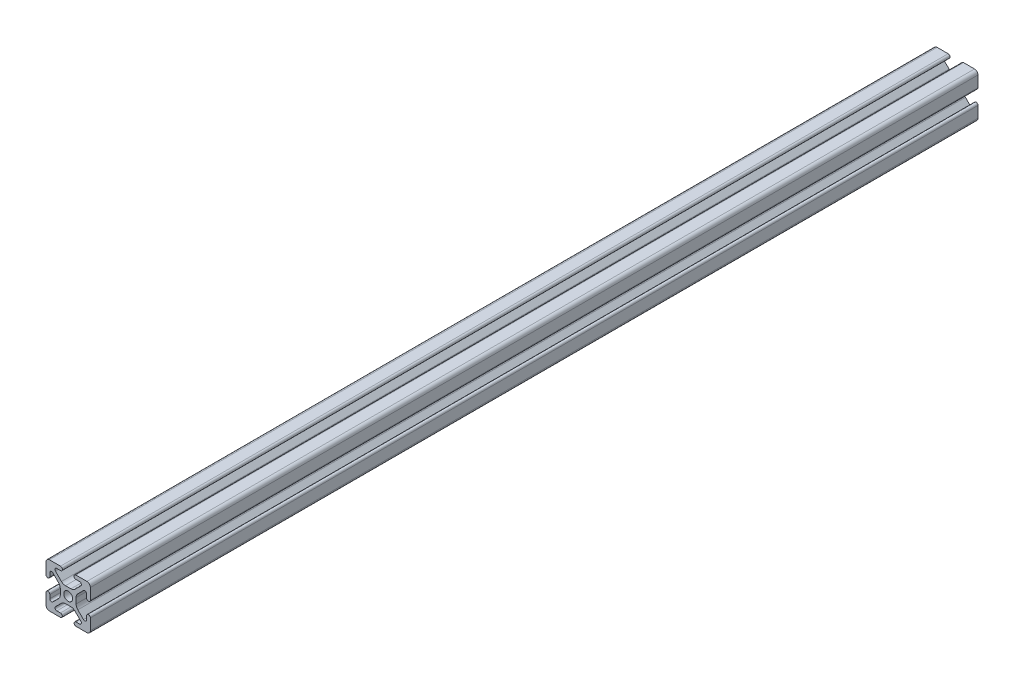
from build123d import *

# Parameters (mm, degrees)
SKETCH1_R           = 2.5
BOSS_EXTRUDE1_DEPTH = 500


with BuildPart() as part:
    # Sketch1 → Boss-Extrude1 (new body)
    with BuildSketch(Plane(origin=(0, 0, -4000), x_dir=(-1, 0, 0), z_dir=(0, 0, -1))):
        with BuildLine():
            Line((12.5, 4.32), (12.5, 10.537068835))
            ThreePointArc((12.5, 10.537068835), (11.925070773, 11.925070773), (10.537068835, 12.5))
            Line((10.537068835, 12.5), (4.32, 12.5))
            ThreePointArc((4.32, 12.5), (3.25, 11.43), (4.32, 10.36))
            Line((4.32, 10.36), (6.42, 10.36))
            ThreePointArc((6.42, 10.36), (7.35325999, 9.736168088), (7.133653911, 8.635298598))
            Line((7.133653911, 8.635298598), (3.795290766, 5.301828272))
            ThreePointArc((3.795290766, 5.301828272), (2.76743922, 4.61585726), (1.555406707, 4.375))
            Line((1.555406707, 4.375), (-1.555406707, 4.375))
            ThreePointArc((-1.555406707, 4.375), (-2.76743922, 4.61585726), (-3.795290766, 5.301828272))
            Line((-3.795290766, 5.301828272), (-7.133653912, 8.635298598))
            ThreePointArc((-7.133653912, 8.635298598), (-7.35325999, 9.736168088), (-6.42, 10.36))
            Line((-6.42, 10.36), (-4.32, 10.36))
            ThreePointArc((-4.32, 10.36), (-3.25, 11.43), (-4.32, 12.5))
            Line((-4.32, 12.5), (-10.537068835, 12.5))
            ThreePointArc((-10.537068835, 12.5), (-11.925070773, 11.925070773), (-12.5, 10.537068835))
            Line((-12.5, 10.537068835), (-12.5, 4.32))
            ThreePointArc((-12.5, 4.32), (-11.43, 3.25), (-10.36, 4.32))
            Line((-10.36, 4.32), (-10.36, 6.396886949))
            ThreePointArc((-10.36, 6.396886949), (-9.736852394, 7.329863489), (-8.636346088, 7.111588351))
            Line((-8.636346088, 7.111588351), (-5.432204773, 3.912143135))
            ThreePointArc((-5.432204773, 3.912143135), (-4.708985779, 2.831057106), (-4.455, 1.555406707))
            Line((-4.455, 1.555406707), (-4.455, -1.555406707))
            ThreePointArc((-4.455, -1.555406707), (-4.708985779, -2.831057106), (-5.432204773, -3.912143135))
            Line((-5.432204773, -3.912143135), (-8.636346088, -7.111588351))
            ThreePointArc((-8.636346088, -7.111588351), (-9.736852394, -7.329863489), (-10.36, -6.396886949))
            Line((-10.36, -6.396886949), (-10.36, -4.32))
            ThreePointArc((-10.36, -4.32), (-11.43, -3.25), (-12.5, -4.32))
            Line((-12.5, -4.32), (-12.5, -10.537068835))
            ThreePointArc((-12.5, -10.537068835), (-11.925070773, -11.925070773), (-10.537068835, -12.5))
            Line((-10.537068835, -12.5), (-4.387856959, -12.5))
            ThreePointArc((-4.387856959, -12.5), (-3.317856959, -11.43), (-4.387856959, -10.36))
            Line((-4.387856959, -10.36), (-6.42, -10.36))
            ThreePointArc((-6.42, -10.36), (-7.35325999, -9.736168088), (-7.133653912, -8.635298598))
            Line((-7.133653912, -8.635298598), (-3.795290766, -5.301828272))
            ThreePointArc((-3.795290766, -5.301828272), (-2.76743922, -4.61585726), (-1.555406707, -4.375))
            Line((-1.555406707, -4.375), (1.555406707, -4.375))
            ThreePointArc((1.555406707, -4.375), (2.76743922, -4.61585726), (3.795290766, -5.301828272))
            Line((3.795290766, -5.301828272), (7.133653912, -8.635298598))
            ThreePointArc((7.133653912, -8.635298598), (7.35325999, -9.736168088), (6.42, -10.36))
            Line((6.42, -10.36), (4.387856959, -10.36))
            ThreePointArc((4.387856959, -10.36), (3.317856959, -11.43), (4.387856959, -12.5))
            Line((4.387856959, -12.5), (10.537068835, -12.5))
            ThreePointArc((10.537068835, -12.5), (11.925070773, -11.925070773), (12.5, -10.537068835))
            Line((12.5, -10.537068835), (12.5, -4.32))
            ThreePointArc((12.5, -4.32), (11.43, -3.25), (10.36, -4.32))
            Line((10.36, -4.32), (10.36, -6.396886949))
            ThreePointArc((10.36, -6.396886949), (9.736852394, -7.329863489), (8.636346088, -7.111588351))
            Line((8.636346088, -7.111588351), (5.432204773, -3.912143135))
            ThreePointArc((5.432204773, -3.912143135), (4.708985779, -2.831057106), (4.455, -1.555406707))
            Line((4.455, -1.555406707), (4.455, 1.555406707))
            ThreePointArc((4.455, 1.555406707), (4.708985779, 2.831057106), (5.432204773, 3.912143135))
            Line((5.432204773, 3.912143135), (8.636346088, 7.111588351))
            ThreePointArc((8.636346088, 7.111588351), (9.736852394, 7.329863489), (10.36, 6.396886949))
            Line((10.36, 6.396886949), (10.36, 4.32))
            ThreePointArc((10.36, 4.32), (11.43, 3.25), (12.5, 4.32))
        make_face()
        with Locations(Location((0, 0, 0), (0, 0, 180))):
            Circle(SKETCH1_R, mode=Mode.SUBTRACT)
    extrude(amount=-BOSS_EXTRUDE1_DEPTH)


solid = part.part
